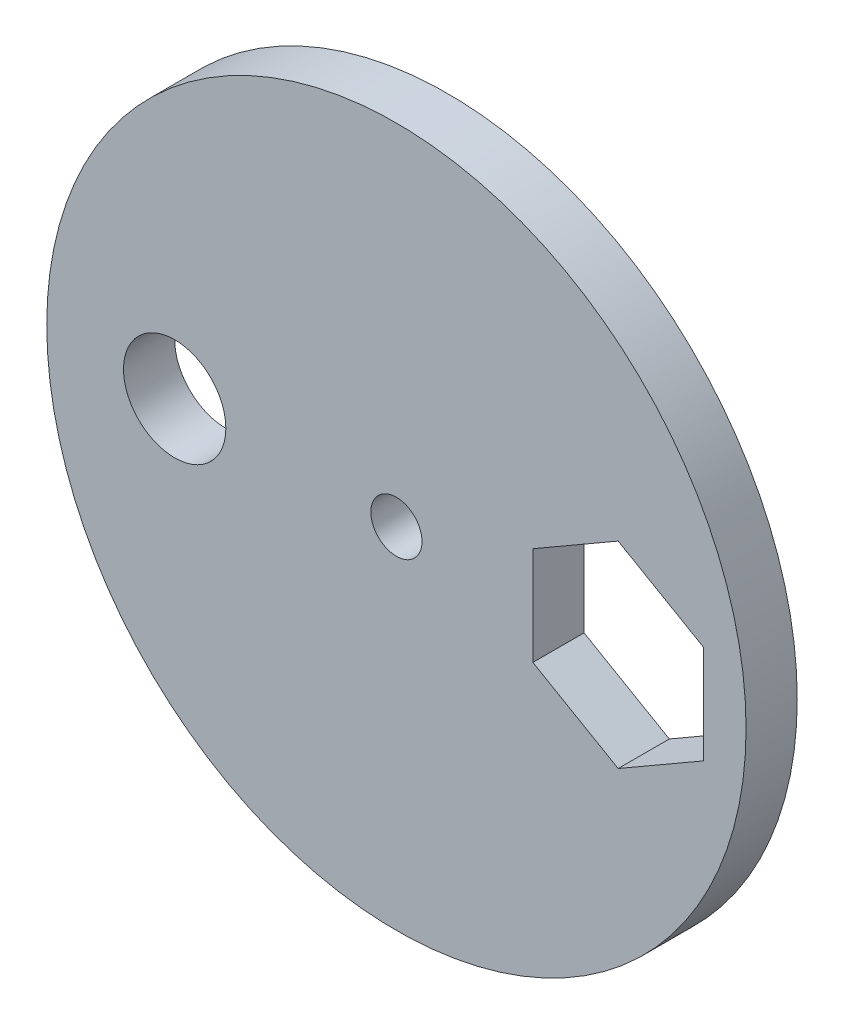
from build123d import *

# Parameters (mm, degrees)
SKETCH1_R           = 20.5
SKETCH1_R_2         = 3
SKETCH1_R_3         = 1.5
BOSS_EXTRUDE1_DEPTH = 3


with BuildPart() as part:
    # Sketch1 → Boss-Extrude1 (new body)
    with BuildSketch(Plane.XY):
        Circle(SKETCH1_R)
        with Locations((-13, 0)):
            Circle(SKETCH1_R_2, mode=Mode.SUBTRACT)
        Circle(SKETCH1_R_3, mode=Mode.SUBTRACT)
        Polygon((18, 2.886751346), (13, 5.773502692), (8, 2.886751346), (8, -2.886751346), (13, -5.773502692), (18, -2.886751346), align=None, mode=Mode.SUBTRACT)
    extrude(amount=BOSS_EXTRUDE1_DEPTH)


solid = part.part
